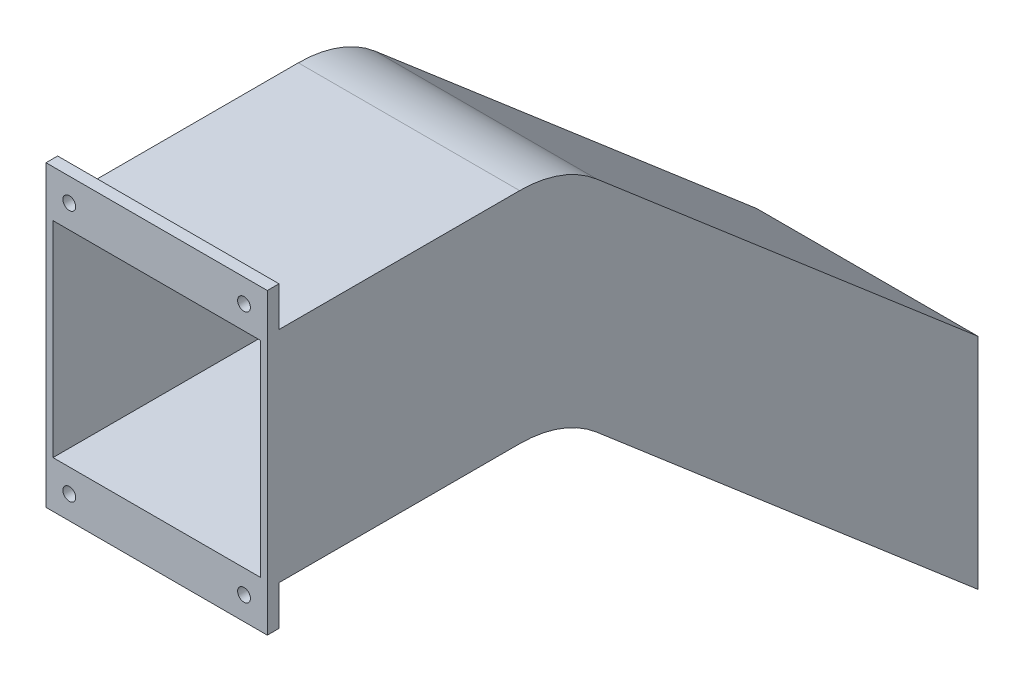
from build123d import *

# Parameters (mm, degrees)
SKETCH1_W           = 94.925
SKETCH1_H           = 94.024999972
BOSS_EXTRUDE1_DEPTH = 127
BOSS_EXTRUDE2_DEPTH = 94.925
FILLET1_R           = 50.8
SHELL1_T            = -3
SKETCH3_W           = 94.925
SKETCH3_H           = 5
BOSS_EXTRUDE3_DEPTH = 16.999999878
SKETCH4_W           = 94.925
SKETCH4_H           = 5
BOSS_EXTRUDE4_DEPTH = 16.999999878
CUT_EXTRUDE1_REACH  = 365.178
SKETCH5_R           = 2.75


with BuildPart() as part:
    # Sketch1 → Boss-Extrude1 (new body)
    with BuildSketch(Plane.XY):
        Rectangle(SKETCH1_W, SKETCH1_H)
    extrude(amount=BOSS_EXTRUDE1_DEPTH)

    # Sketch2 → Boss-Extrude2 (add)
    with BuildSketch(Plane(origin=(47.4625, 0, 0), x_dir=(0, 0, -1), z_dir=(1, 0, 0))):
        Polygon((0, -47.012499986), (177.8, -199.412499986), (177.8, -105.387500014), (0, 47.012499986), align=None)
    extrude(amount=-BOSS_EXTRUDE2_DEPTH)

    # Fillet1
    fillet1_edges = [part.edges().sort_by_distance(p)[0] for p in [
        (0, -47.012499986, 0),
        (0, 47.012499986, 0),
    ]]
    fillet(fillet1_edges, radius=FILLET1_R)

    # Shell1
    shell1_openings = [part.faces().sort_by_distance(p)[0] for p in [
        (0, 0, 127),
        (0, -152.4, -177.8),
    ]]
    offset(amount=SHELL1_T, openings=shell1_openings, kind=Kind.INTERSECTION)

    # Sketch3 → Boss-Extrude3 (add)
    with BuildSketch(Plane(origin=(0, -47.012499986, 0), x_dir=(-1, 0, 0), z_dir=(0, -1, 0))):
        with Locations((0, -124.5)):
            Rectangle(SKETCH3_W, SKETCH3_H)
    extrude(amount=BOSS_EXTRUDE3_DEPTH)

    # Sketch4 → Boss-Extrude4 (add)
    with BuildSketch(Plane(origin=(0, 47.012499986, 0), x_dir=(1, 0, 0), z_dir=(0, 1, 0))):
        with Locations((0, -124.5)):
            Rectangle(SKETCH4_W, SKETCH4_H)
    extrude(amount=BOSS_EXTRUDE4_DEPTH)

    # Sketch5 → Cut-Extrude1 (cut, up to next)
    with BuildSketch(Plane(origin=(0, 0, 122), x_dir=(-1, 0, 0), z_dir=(0, 0, -1)), mode=Mode.PRIVATE) as cut_extrude1_sk1:
        with Locations((37.4625, 54.012499864)):
            Circle(SKETCH5_R)
    cut_extrude1_tool1 = extrude(cut_extrude1_sk1.sketch, amount=-CUT_EXTRUDE1_REACH, mode=Mode.PRIVATE) & part.part
    # Sketch5 → Cut-Extrude1 (cut, up to next)
    with BuildSketch(Plane(origin=(0, 0, 122), x_dir=(-1, 0, 0), z_dir=(0, 0, -1)), mode=Mode.PRIVATE) as cut_extrude1_sk2:
        with Locations((-37.4625, 54.012499864)):
            Circle(SKETCH5_R)
    cut_extrude1_tool2 = extrude(cut_extrude1_sk2.sketch, amount=-CUT_EXTRUDE1_REACH, mode=Mode.PRIVATE) & part.part
    # Sketch5 → Cut-Extrude1 (cut, up to next)
    with BuildSketch(Plane(origin=(0, 0, 122), x_dir=(-1, 0, 0), z_dir=(0, 0, -1)), mode=Mode.PRIVATE) as cut_extrude1_sk3:
        with Locations((37.4625, -54.012499864)):
            Circle(SKETCH5_R)
    cut_extrude1_tool3 = extrude(cut_extrude1_sk3.sketch, amount=-CUT_EXTRUDE1_REACH, mode=Mode.PRIVATE) & part.part
    # Sketch5 → Cut-Extrude1 (cut, up to next)
    with BuildSketch(Plane(origin=(0, 0, 122), x_dir=(-1, 0, 0), z_dir=(0, 0, -1)), mode=Mode.PRIVATE) as cut_extrude1_sk4:
        with Locations((-37.4625, -54.012499864)):
            Circle(SKETCH5_R)
    cut_extrude1_tool4 = extrude(cut_extrude1_sk4.sketch, amount=-CUT_EXTRUDE1_REACH, mode=Mode.PRIVATE) & part.part
    add(cut_extrude1_tool1.solids().sort_by_distance((-37.4625, 54.0125, 122))[0], mode=Mode.SUBTRACT)
    add(cut_extrude1_tool2.solids().sort_by_distance((37.4625, 54.0125, 122))[0], mode=Mode.SUBTRACT)
    add(cut_extrude1_tool3.solids().sort_by_distance((-37.4625, -54.0125, 122))[0], mode=Mode.SUBTRACT)
    add(cut_extrude1_tool4.solids().sort_by_distance((37.4625, -54.0125, 122))[0], mode=Mode.SUBTRACT)


solid = part.part
